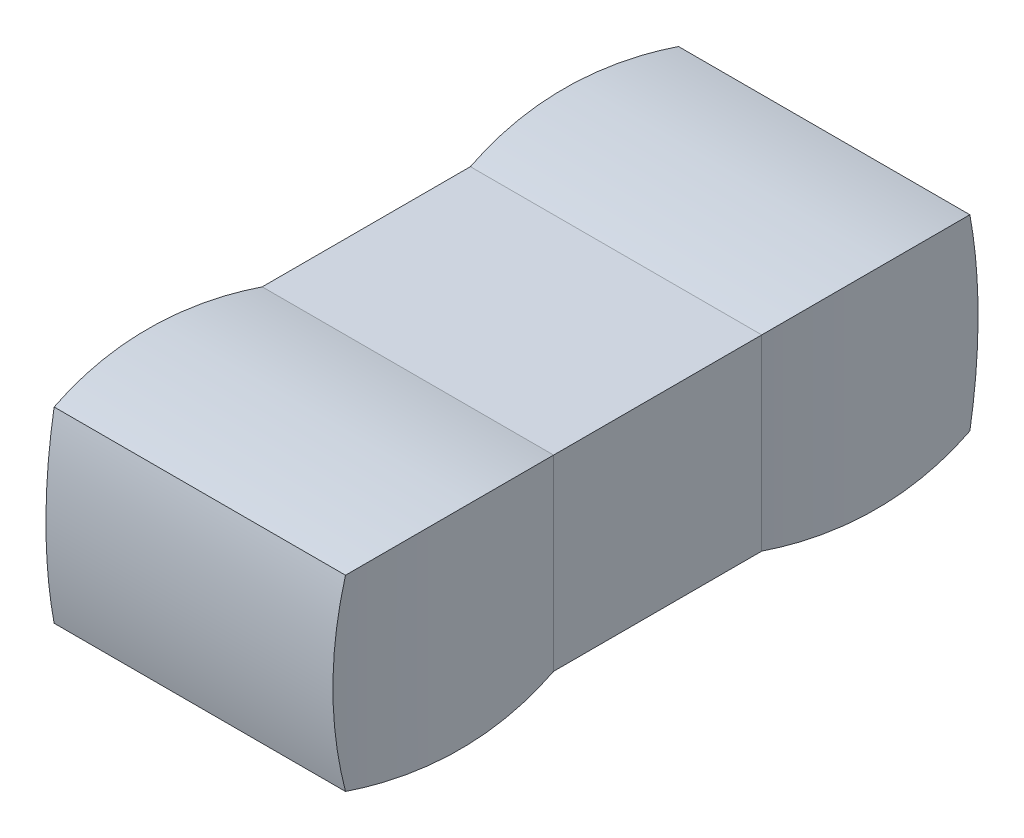
from build123d import *

# Parameters (mm, degrees)
SKETCH1_W            = 0.508
SKETCH1_H            = 0.4572
BOSS_EXTRUDE1_DEPTH  = 0.3556
BOSS_EXTRUDE3_DEPTH  = 0.4572
CUT_EXTRUDE1_DEPTH   = 0.4572
MIRROR2_COPY_1_DEPTH = 0.4572


with BuildPart() as part:
    # Sketch1 → Boss-Extrude1 (new, symmetric)
    with BuildSketch(Plane(origin=(0, 0, 0), x_dir=(0, 0, -1), z_dir=(1, 0, 0))):
        Rectangle(SKETCH1_W, SKETCH1_H)
    extrude(amount=BOSS_EXTRUDE1_DEPTH, both=True)

    # Sketch3 → Boss-Extrude3 (add, symmetric)
    with BuildSketch(Plane(origin=(0, 0, 0), x_dir=(0, 0, -1), z_dir=(1, 0, 0))):
        with BuildLine():
            Line((0.254, 0.2286), (0.254, -0.2286))
            ThreePointArc((0.254, -0.2286), (0.508, -0.254), (0.762, -0.2286))
            ThreePointArc((0.762, -0.2286), (0.7874, 0), (0.762, 0.2286))
            ThreePointArc((0.762, 0.2286), (0.508, 0.254), (0.254, 0.2286))
        make_face()
    boss_extrude3 = extrude(amount=BOSS_EXTRUDE3_DEPTH, both=True)

    # Sketch4 → Cut-Extrude1 (cut, symmetric)
    with BuildSketch(Plane(origin=(0, 0, 0), x_dir=(1, 0, 0), z_dir=(0, 1, 0))):
        with BuildLine():
            Line((0.3556, 0.254), (0.582576635, 0.027023365))
            Line((0.582576635, 0.027023365), (0.582576635, 1.080487575))
            Line((0.582576635, 1.080487575), (0.338299002, 0.836209942))
            ThreePointArc((0.338299002, 0.836209942), (0.380434034, 0.5461), (0.3556, 0.254))
        make_face()
    cut_extrude1 = extrude(amount=CUT_EXTRUDE1_DEPTH, both=True, mode=Mode.SUBTRACT)

    # Mirror1: Cut-Extrude1 across plane
    add(cut_extrude1.mirror(Plane(origin=(0, 0, 0), x_dir=(0, 0, 1), z_dir=(1, 0, 0))), mode=Mode.SUBTRACT)

    # Mirror2: Boss-Extrude3, Cut-Extrude1 across plane
    add(boss_extrude3.mirror(Plane.XY))
    add(cut_extrude1.mirror(Plane.XY), mode=Mode.SUBTRACT)

    # Mirror2 copy 1 sketch → Mirror2 copy 1 (cut, symmetric)
    with BuildSketch(Plane(origin=(0, 0, 0), x_dir=(-1, 0, 0), z_dir=(0, 1, 0))):
        with BuildLine():
            Line((0.3556, 0.254), (0.582576635, 0.027023365))
            Line((0.582576635, 0.027023365), (0.582576635, 1.080487575))
            Line((0.582576635, 1.080487575), (0.338299002, 0.836209942))
            ThreePointArc((0.338299002, 0.836209942), (0.380434034, 0.5461), (0.3556, 0.254))
        make_face()
    extrude(amount=MIRROR2_COPY_1_DEPTH, both=True, mode=Mode.SUBTRACT)


solid = part.part
